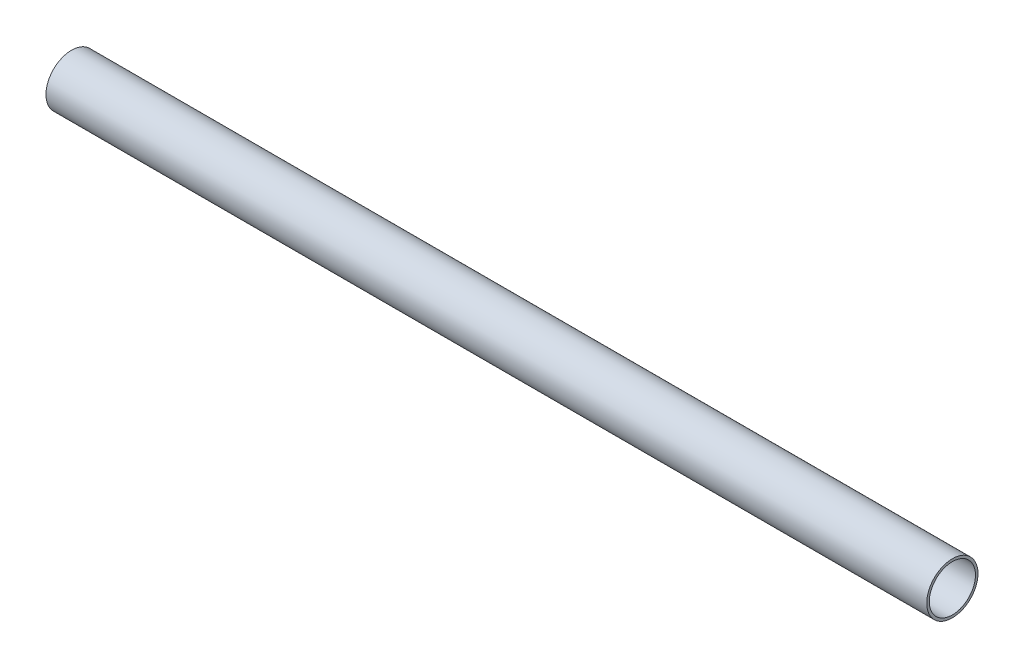
from build123d import *

# Parameters (mm, degrees)
SKETCH1_R           = 30.15
SKETCH1_R_2         = 27.15
BOSS_EXTRUDE1_DEPTH = 1036


with BuildPart() as part:
    # Sketch1 → Boss-Extrude1 (new body)
    with BuildSketch(Plane(origin=(0, 0, 0), x_dir=(0, 0, -1), z_dir=(1, 0, 0))):
        Circle(SKETCH1_R)
        Circle(SKETCH1_R_2, mode=Mode.SUBTRACT)
    extrude(amount=BOSS_EXTRUDE1_DEPTH)


solid = part.part
